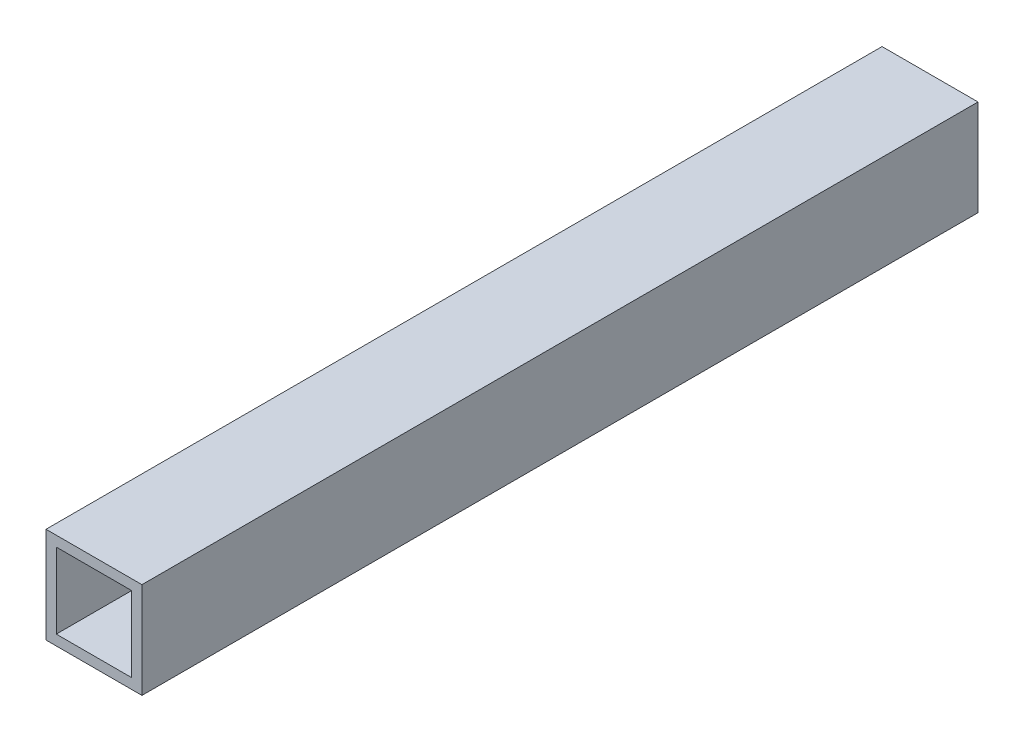
from build123d import *

# Parameters (mm, degrees)
SKETCH_1_W      = 14
SKETCH_1_H      = 14
SKETCH_1_W_2    = 11
SKETCH_1_H_2    = 11
EXTRUDE_1_DEPTH = 122


with BuildPart() as part:
    # 草图1 → 拉伸-薄壁1 (new body)
    with BuildSketch(Plane.XY):
        Rectangle(SKETCH_1_W, SKETCH_1_H)
        Rectangle(SKETCH_1_W_2, SKETCH_1_H_2, mode=Mode.SUBTRACT)
    extrude(amount=EXTRUDE_1_DEPTH)


solid = part.part
